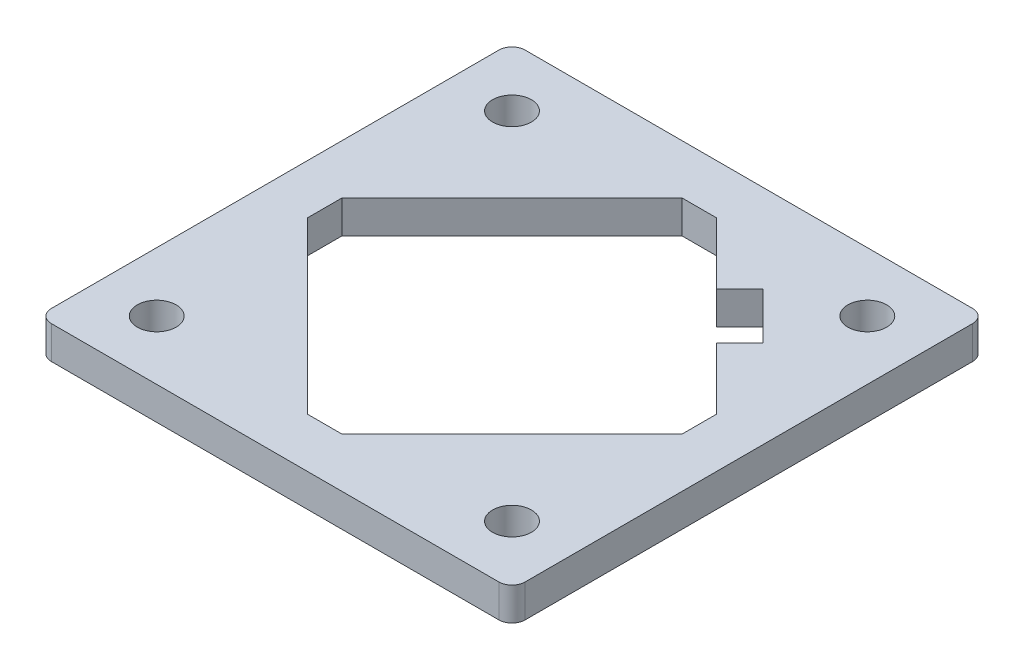
from build123d import *

# Parameters (mm, degrees)
SKETCH1_W           = 72
SKETCH1_H           = 72
SKETCH1_R           = 2.95
BOSS_EXTRUDE1_DEPTH = 5
FILLET1_R           = 2


with BuildPart() as part:
    # Sketch1 → Boss-Extrude1 (new body)
    with BuildSketch(Plane(origin=(0, 0, 0), x_dir=(1, 0, 0), z_dir=(0, 1, 0))):
        Rectangle(SKETCH1_W, SKETCH1_H)
        with Locations(Location((-27, 27, 0), (0, 0, 270))):
            Circle(SKETCH1_R, mode=Mode.SUBTRACT)
        with Locations(Location((27, -27, 0), (0, 0, 270))):
            Circle(SKETCH1_R, mode=Mode.SUBTRACT)
        with Locations(Location((-27, -27, 0), (0, 0, 270))):
            Circle(SKETCH1_R, mode=Mode.SUBTRACT)
        with Locations(Location((27, 27, 0), (0, 0, 270))):
            Circle(SKETCH1_R, mode=Mode.SUBTRACT)
        Polygon((-28.461047943, -2.651650429), (-2.651650429, -28.461047943), (2.651650429, -28.461047943), (28.461047943, -2.651650429), (28.461047943, 2.651650429), (19.091883092, 12.02081528), (22.627416998, 15.556349186), (15.556349186, 22.627416998), (12.02081528, 19.091883092), (2.651650429, 28.461047943), (-2.651650429, 28.461047943), (-28.461047943, 2.651650429), align=None, mode=Mode.SUBTRACT)
    extrude(amount=BOSS_EXTRUDE1_DEPTH)

    # Fillet1
    fillet1_edges = [part.edges().sort_by_distance(p)[0] for p in [
        (36, 2.5, 36),
        (-36, 2.5, 36),
        (-36, 2.5, -36),
        (36, 2.5, -36),
    ]]
    fillet(fillet1_edges, radius=FILLET1_R)


solid = part.part
